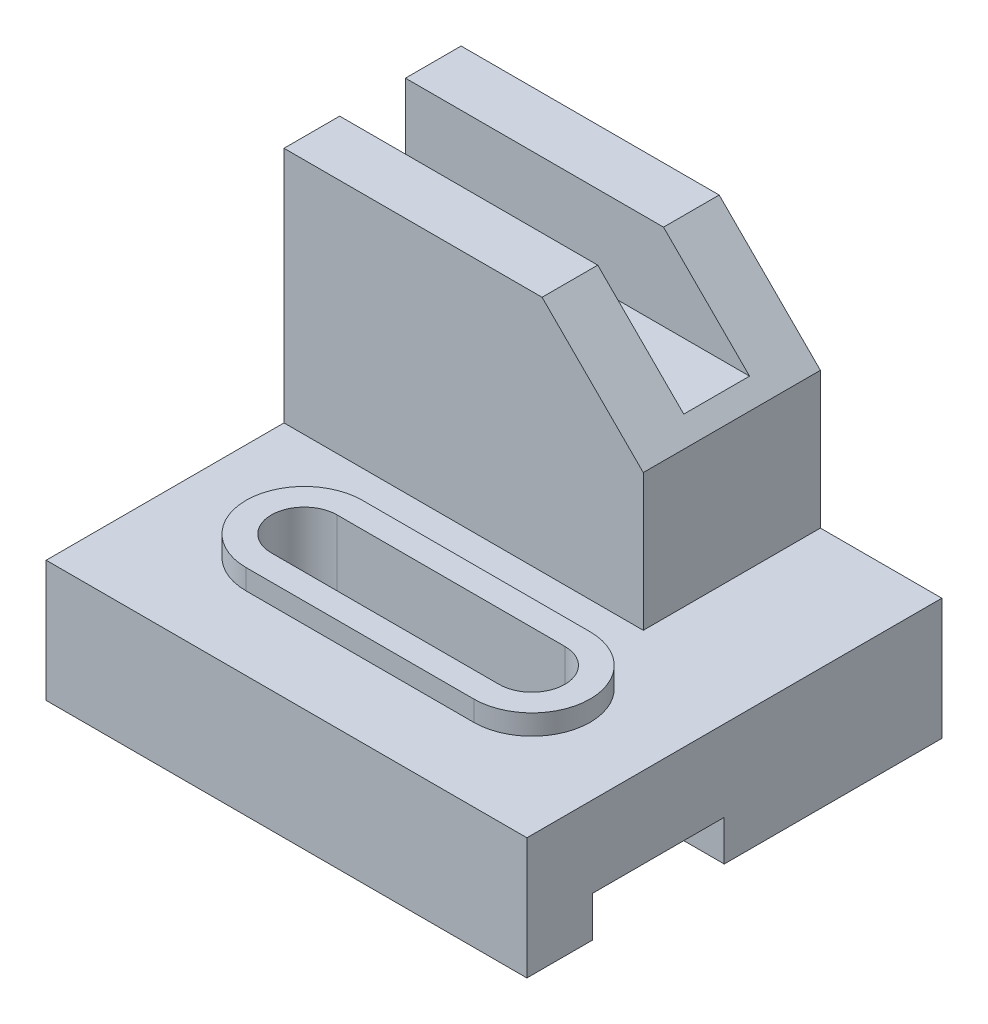
from build123d import *

# Parameters (mm, degrees)
BOSS_EXTRUDE1_DEPTH = 24
BOSS_EXTRUDE2_DEPTH = 28
SKETCH1_4_W         = 71
SKETCH1_4_H         = 11
BOSS_EXTRUDE3_DEPTH = 71
SKETCH1_5_W         = 71
SKETCH1_5_H         = 13
BOSS_EXTRUDE4_DEPTH = 54
SKETCH2_W           = 26
SKETCH2_H           = 8
CUT_EXTRUDE1_DEPTH  = 96
CHAMFER1_SIZE       = 20


with BuildPart() as part:
    # Sketch1 → Boss-Extrude1 (new body)
    with BuildSketch(Plane(origin=(0, 0, 0), x_dir=(1, 0, 0), z_dir=(0, 1, 0))):
        Polygon((0, 47), (0, 0), (95, 0), (95, 82), (71, 82), (71, 71), (71, 58), (71, 47), align=None)
        with BuildLine():
            ThreePointArc((25, 14.5), (13.5, 26), (25, 37.5))
            Line((25, 37.5), (70, 37.5))
            ThreePointArc((70, 37.5), (81.5, 26), (70, 14.5))
            Line((70, 14.5), (25, 14.5))
        make_face(mode=Mode.SUBTRACT)
    extrude(amount=BOSS_EXTRUDE1_DEPTH)

    # Sketch1<3> → Boss-Extrude2 (add)
    with BuildSketch(Plane(origin=(0, 0, 0), x_dir=(1, 0, 0), z_dir=(0, 1, 0))):
        with BuildLine():
            Line((70, 37.5), (25, 37.5))
            ThreePointArc((25, 37.5), (13.5, 26), (25, 14.5))
            Line((25, 14.5), (70, 14.5))
            ThreePointArc((70, 14.5), (81.5, 26), (70, 37.5))
        make_face()
        with BuildLine():
            ThreePointArc((25, 19.5), (18.5, 26), (25, 32.5))
            Line((25, 32.5), (70, 32.5))
            ThreePointArc((70, 32.5), (76.5, 26), (70, 19.5))
            Line((70, 19.5), (25, 19.5))
        make_face(mode=Mode.SUBTRACT)
    extrude(amount=BOSS_EXTRUDE2_DEPTH)

    # Sketch1<4> → Boss-Extrude3 (add)
    with BuildSketch(Plane(origin=(0, 0, 0), x_dir=(1, 0, 0), z_dir=(0, 1, 0))):
        with Locations((35.5, 52.5)):
            Rectangle(SKETCH1_4_W, SKETCH1_4_H)
        with Locations((35.5, 76.5)):
            Rectangle(SKETCH1_4_W, SKETCH1_4_H)
    extrude(amount=BOSS_EXTRUDE3_DEPTH)

    # Sketch1<5> → Boss-Extrude4 (add)
    with BuildSketch(Plane(origin=(0, 0, 0), x_dir=(1, 0, 0), z_dir=(0, 1, 0))):
        with Locations((35.5, 64.5)):
            Rectangle(SKETCH1_5_W, SKETCH1_5_H)
    extrude(amount=BOSS_EXTRUDE4_DEPTH)

    # Sketch2 → Cut-Extrude1 (cut)
    with BuildSketch(Plane(origin=(95, 0, 0), x_dir=(0, 0, -1), z_dir=(1, 0, 0))):
        with Locations((26, 4)):
            Rectangle(SKETCH2_W, SKETCH2_H)
    extrude(amount=-CUT_EXTRUDE1_DEPTH, mode=Mode.SUBTRACT)

    # Chamfer1
    chamfer1_edges = [part.edges().sort_by_distance(p)[0] for p in [
        (71, 71, -76.5),
    ]]
    chamfer(chamfer1_edges, length=CHAMFER1_SIZE)


solid = part.part
